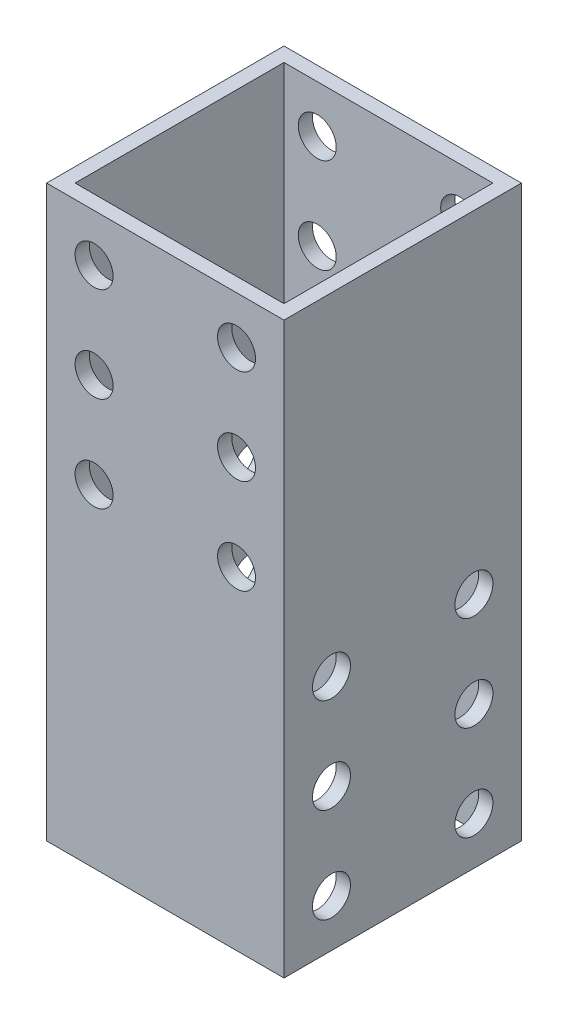
from build123d import *

# Parameters (mm, degrees)
BOSS_EXTRUDE1_DEPTH      = 30
BOSS_EXTRUDE1_DEPTH_BACK = 30
SKETCH3_W                = 25
SKETCH3_H                = 25
SKETCH3_W_2              = 22
SKETCH3_H_2              = 22
SKETCH6_R                = 2
CUT_EXTRUDE3_DEPTH       = 25
SKETCH7_R                = 2
CUT_EXTRUDE4_DEPTH       = 25


with BuildPart() as part:
    # Sketch3 → Boss-Extrude1 (new, two sides: drawn at the far end of the back side and taken through both)
    with BuildSketch(Plane(origin=(0, 0, 0), x_dir=(1, 0, 0), z_dir=(0, 1, 0)).offset(-BOSS_EXTRUDE1_DEPTH_BACK)):
        Rectangle(SKETCH3_W, SKETCH3_H)
        Rectangle(SKETCH3_W_2, SKETCH3_H_2, mode=Mode.SUBTRACT)
    extrude(amount=BOSS_EXTRUDE1_DEPTH + BOSS_EXTRUDE1_DEPTH_BACK)

    # Sketch6 → Cut-Extrude3 (cut)
    with BuildSketch(Plane(origin=(12.5, 0, 0), x_dir=(0, 0, -1), z_dir=(1, 0, 0))):
        with Locations((7.5, -25)):
            Circle(SKETCH6_R)
        with Locations((7.5, -5)):
            Circle(SKETCH6_R)
        with Locations((-7.5, -25)):
            Circle(SKETCH6_R)
        with Locations((-7.5, -5)):
            Circle(SKETCH6_R)
        with Locations((7.5, -15)):
            Circle(SKETCH6_R)
        with Locations((-7.5, -15)):
            Circle(SKETCH6_R)
    extrude(amount=-CUT_EXTRUDE3_DEPTH, mode=Mode.SUBTRACT)

    # Sketch7 → Cut-Extrude4 (cut)
    with BuildSketch(Plane(origin=(0, 0, -12.5), x_dir=(-1, 0, 0), z_dir=(0, 0, -1))):
        with Locations((7.5, 25)):
            Circle(SKETCH7_R)
        with Locations((7.5, 15)):
            Circle(SKETCH7_R)
        with Locations((-7.5, 25)):
            Circle(SKETCH7_R)
        with Locations((-7.5, 15)):
            Circle(SKETCH7_R)
        with Locations((-7.5, 5)):
            Circle(SKETCH7_R)
        with Locations((7.5, 5)):
            Circle(SKETCH7_R)
    extrude(amount=-CUT_EXTRUDE4_DEPTH, mode=Mode.SUBTRACT)


solid = part.part
